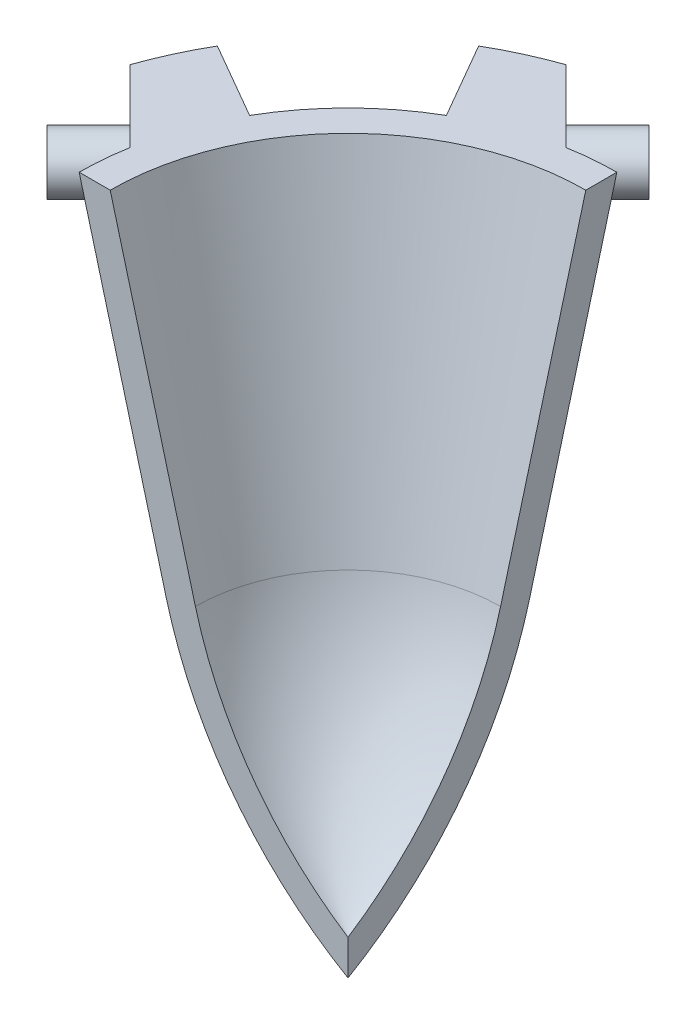
from build123d import *

# Parameters (mm, degrees)
REVOLUCI_N1_ANGLE       = 90
REVOLUCI_N2_ANGLE       = 20
REVOLUCI_N3_ANGLE       = 20
CORTAR_EXTRUIR1_DEPTH   = 129.015444104
CROQUIS13_R             = 4.5
SALIENTE_EXTRUIR1_DEPTH = 10


with BuildPart() as part:
    # Croquis2 → Revolución1 (revolve)
    with BuildSketch(Plane(origin=(0, 0, 0), x_dir=(0, 0, -1), z_dir=(1, 0, 0))):
        with BuildLine():
            Line((0, 0), (0, 6))
            ThreePointArc((0, 6), (16.315231643, 21.503634207), (26, 41.82))
            Line((26, 41.82), (40.517487246, 96))
            Line((40.517487246, 96), (45.806819571, 96))
            Line((45.806819571, 96), (30.935014244, 40.497666919))
            ThreePointArc((30.935014244, 40.497666919), (19.472326357, 17.189666117), (0, 0))
        make_face()
    revolve(axis=Axis((0, 0, 0), (0, 1, 0)), revolution_arc=REVOLUCI_N1_ANGLE)

    # Croquis10 → Revolución2 (revolve)
    with BuildSketch(Plane(origin=(0, 0, 0), x_dir=(0, 1, 0), z_dir=(0.866025403784438, 0, -0.500000000000001))):
        Polygon((81, -41.787581685), (96, -45.806819571), (96, -60.806819571), (81, -56.787581685), align=None)
    revolve(axis=Axis((0, 0, 0), (0, -1, 0)), revolution_arc=REVOLUCI_N2_ANGLE)

    # Croquis11 → Revolución3 (revolve)
    with BuildSketch(Plane(origin=(0, 0, 0), x_dir=(0, 1, 0), z_dir=(0.499999999999998, 1.4337406519976025e-15, -0.8660254037844398))):
        Polygon((96, -45.806819571), (96, -60.806819571), (81, -56.787581685), (81, -41.787581685), align=None)
    revolve(axis=Axis((0, 0, 0), (0, 1, 0)), revolution_arc=REVOLUCI_N3_ANGLE)

    # Croquis12 → Cortar-Extruir1 (cut, through all)
    with BuildSketch(Plane(origin=(0, 96, 0), x_dir=(1, 0, 0), z_dir=(0, 1, 0))):
        with BuildLine():
            Line((-7.954270743, 45.110911055), (-20.197712047, 57.354352358))
            ThreePointArc((-20.197712047, 57.354352358), (-15.430239205, 58.81646899), (-10.558993408, 59.88302735))
            Line((-10.558993408, 59.88302735), (-7.954270743, 45.110911055))
        make_face()
        with BuildLine():
            Line((-45.110911055, 7.954270743), (-57.354352358, 20.197712047))
            ThreePointArc((-57.354352358, 20.197712047), (-58.81646899, 15.430239205), (-59.88302735, 10.558993408))
            Line((-59.88302735, 10.558993408), (-45.110911055, 7.954270743))
        make_face()
    extrude(amount=-CORTAR_EXTRUIR1_DEPTH, mode=Mode.SUBTRACT)

    # Croquis13 → Saliente-Extruir1 (add)
    with BuildSketch(Plane(origin=(18.578320156, 0, -18.578320156), x_dir=(-0.7071067811865489, 0, -0.7071067811865461), z_dir=(0.7071067811865461, 0, -0.7071067811865489))):
        with Locations(Location((45.056780398, 88.5, 0), (0, 0, 180))):
            Circle(CROQUIS13_R)
    saliente_extruir1 = extrude(amount=SALIENTE_EXTRUIR1_DEPTH)

    # Simetría1: Saliente-Extruir1 across plane
    add(saliente_extruir1.mirror(Plane(origin=(0, 0, 0), x_dir=(0.7071067811865488, 1.170644340293136e-15, 0.7071067811865464), z_dir=(0.7071067811865462, 1.1706443402931319e-15, -0.7071067811865488))))


solid = part.part
